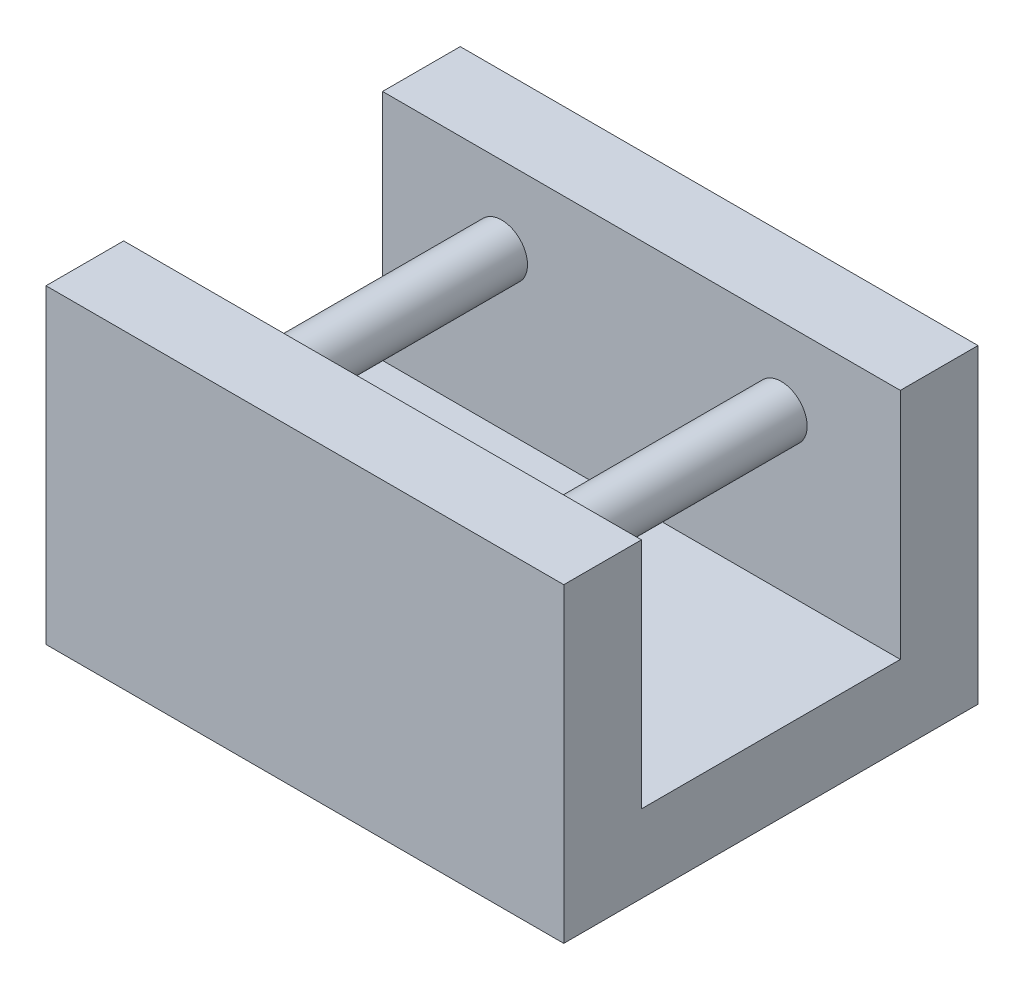
from build123d import *

# Parameters (mm, degrees)
BOSS_EXTRUDE1_DEPTH = 100
SKETCH2_R           = 5
BOSS_EXTRUDE2_DEPTH = 50


with BuildPart() as part:
    # Sketch1 → Boss-Extrude1 (new body)
    with BuildSketch(Plane(origin=(0, 0, 0), x_dir=(0, 0, -1), z_dir=(1, 0, 0))):
        Polygon((0, 0), (0, 60), (15, 60), (15, 15), (65, 15), (65, 60), (80, 60), (80, 0), align=None)
    extrude(amount=BOSS_EXTRUDE1_DEPTH)

    # Sketch2 → Boss-Extrude2 (add)
    with BuildSketch(Plane(origin=(0, 0, -15), x_dir=(-1, 0, 0), z_dir=(0, 0, -1))):
        with Locations(Location((-77, 45, 0), (0, 0, 270))):
            Circle(SKETCH2_R)
        with Locations(Location((-23, 45, 0), (0, 0, 270))):
            Circle(SKETCH2_R)
    extrude(amount=BOSS_EXTRUDE2_DEPTH)


solid = part.part
